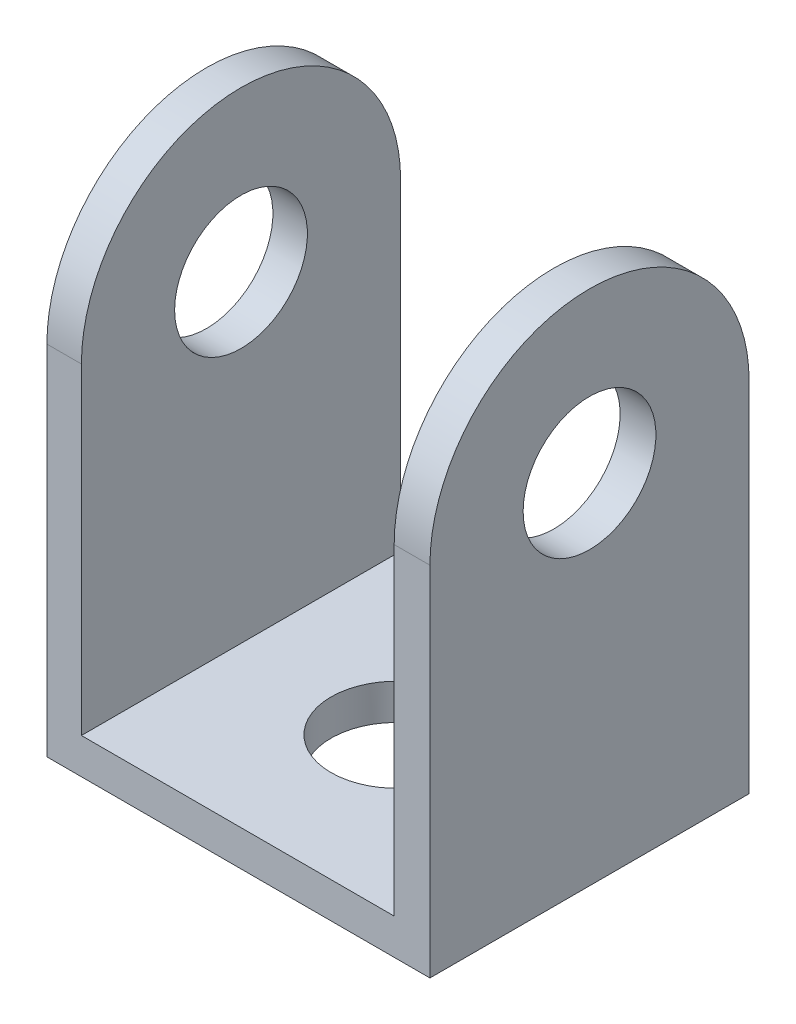
from build123d import *

# Parameters (mm, degrees)
SKETCH2_R           = 7.9375
SKETCH2_R_2         = 3.302
BOSS_EXTRUDE1_DEPTH = 19.05
SKETCH3_W           = 15.555026682
SKETCH3_H           = 25.4
CUT_EXTRUDE1_DEPTH  = 12.7
SKETCH4_R           = 3.2639
CUT_EXTRUDE2_DEPTH  = 28.240315825


with BuildPart() as part:
    # Sketch2 → Boss-Extrude1 (new body)
    # profile 1 of 2: a face of its own
    with BuildSketch(Plane(origin=(0, 0, 0), x_dir=(0, 0, -1), z_dir=(1, 0, 0))):
        with BuildLine():
            ThreePointArc((7.9375, 0), (0, -7.9375), (-7.9375, 0))
            Line((-7.9375, 0), (-7.9375, -17.78))
            Line((-7.9375, -17.78), (7.9375, -17.78))
            Line((7.9375, -17.78), (7.9375, 0))
        make_face()
    # profile 2 of 2: a face of its own
    with BuildSketch(Plane(origin=(0, 0, 0), x_dir=(0, 0, -1), z_dir=(1, 0, 0))):
        Circle(SKETCH2_R)
        with Locations(Location((0, 0, 0), (0, 0, 180))):
            Circle(SKETCH2_R_2, mode=Mode.SUBTRACT)
    extrude(amount=BOSS_EXTRUDE1_DEPTH)

    # Sketch3 → Cut-Extrude1 (cut, symmetric)
    with BuildSketch(Plane.XY):
        with Locations((9.494486659, -3.302)):
            Rectangle(SKETCH3_W, SKETCH3_H)
    extrude(amount=CUT_EXTRUDE1_DEPTH, both=True, mode=Mode.SUBTRACT)

    # Sketch4 → Cut-Extrude2 (cut, through all)
    with BuildSketch(Plane(origin=(0, 0, 0), x_dir=(1, 0, 0), z_dir=(0, 1, 0))):
        with Locations(Location((9.525, -0.0635, 0), (0, 0, 270))):
            Circle(SKETCH4_R)
    extrude(amount=-CUT_EXTRUDE2_DEPTH, mode=Mode.SUBTRACT)


solid = part.part
